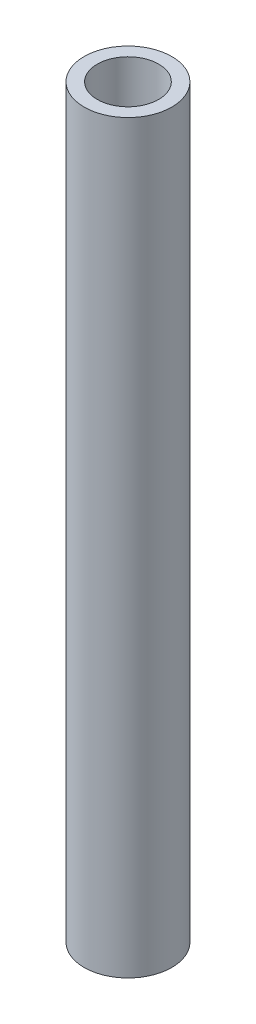
from build123d import *

# Parameters (mm, degrees)
SKETCH2_R           = 5
SKETCH2_R_2         = 3.5
BOSS_EXTRUDE1_DEPTH = 85


with BuildPart() as part:
    # Sketch2 → Boss-Extrude1 (new body)
    with BuildSketch(Plane(origin=(0, 0, 0), x_dir=(1, 0, 0), z_dir=(0, 1, 0))):
        with Locations(Location((0, 0, 0), (0, 0, 270))):
            Circle(SKETCH2_R)
        with Locations(Location((0, 0, 0), (0, 0, 270))):
            Circle(SKETCH2_R_2, mode=Mode.SUBTRACT)
    extrude(amount=BOSS_EXTRUDE1_DEPTH)


solid = part.part
